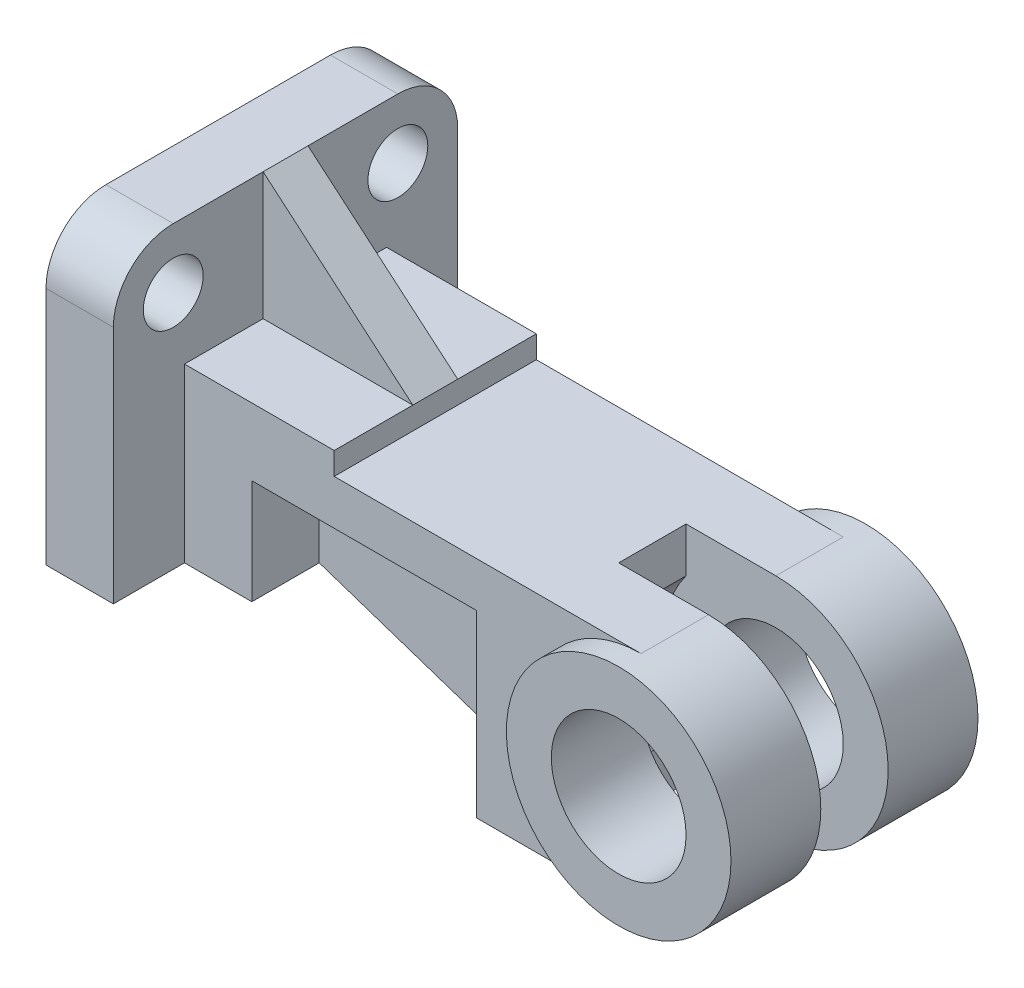
from build123d import *

# Parameters (mm, degrees)
BOSS_EXTRUDE1_DEPTH    = 46
BOSS_EXTRUDE2_DEPTH    = 27
BOSS_EXTRUDE3_START    = 33
SKETCH1_4_R            = 18
BOSS_EXTRUDE3_DEPTH    = 24
FILLET1_R              = 16
BOSS_EXTRUDE4_DEPTH    = 6
BOSS_EXTRUDE5_DEPTH    = 9
F_16_0MM_DOWEL_HOLE1_D = 16
SKETCH3_W              = 48
SKETCH3_H              = 18
CUT_EXTRUDE1_DEPTH     = 88


with BuildPart() as part:
    # Sketch1 → Boss-Extrude1 (new, symmetric)
    with BuildSketch(Plane.XY):
        Polygon((-122, 36), (-122, 70), (-140, 70), (-140, -10), (-122, -10), align=None)
    extrude(amount=BOSS_EXTRUDE1_DEPTH, both=True)

    # Sketch1<3> → Boss-Extrude2 (add, symmetric)
    with BuildSketch(Plane.XY):
        with BuildLine():
            ThreePointArc((0, -30), (-30, 0), (0, 30))
            Line((0, 30), (-82, 30))
            Line((-82, 30), (-82, 36))
            Line((-82, 36), (-122, 36))
            Line((-122, 36), (-122, -10))
            Line((-122, -10), (-104, -10))
            Line((-104, -10), (-104, 18))
            Line((-104, 18), (-44, 18))
            Line((-44, 18), (-44, -30))
            Line((-44, -30), (0, -30))
        make_face()
    extrude(amount=BOSS_EXTRUDE2_DEPTH, both=True)

    # Sketch1<4> → Boss-Extrude3 (add)
    with BuildSketch(Plane.XY.offset(BOSS_EXTRUDE3_START)):
        with BuildLine():
            ThreePointArc((30, 0), (21.213203436, 21.213203436), (0, 30))
            ThreePointArc((0, 30), (-30, 0), (0, -30))
            ThreePointArc((0, -30), (21.213203436, -21.213203436), (30, 0))
        make_face()
        Circle(SKETCH1_4_R, mode=Mode.SUBTRACT)
    boss_extrude3 = extrude(amount=-BOSS_EXTRUDE3_DEPTH)

    # Mirror1: Boss-Extrude3 across plane
    add(boss_extrude3.mirror(Plane.XY))

    # Fillet1
    fillet1_edges = [part.edges().sort_by_distance(p)[0] for p in [
        (-131, 70, -46),
        (-131, 70, 46),
    ]]
    fillet(fillet1_edges, radius=FILLET1_R)

    # Sketch1<7> → Boss-Extrude4 (add, symmetric)
    with BuildSketch(Plane.XY):
        Polygon((-122, 36), (-82, 36), (-122, 70), align=None)
    extrude(amount=BOSS_EXTRUDE4_DEPTH, both=True)

    # Sketch1<8> → Boss-Extrude5 (add, symmetric)
    with BuildSketch(Plane.XY):
        Polygon((-104, -10), (-44, -30), (-44, 18), (-104, 18), align=None)
    extrude(amount=BOSS_EXTRUDE5_DEPTH, both=True)

    # Ø16.0mm Dowel Hole1 (through all)
    with Locations(Plane(origin=(-122, 54, 30), x_dir=(0, 1, 0), z_dir=(1, 0, 0))):
        with Locations((0, 0), (0, -60)):
            Hole(F_16_0MM_DOWEL_HOLE1_D / 2)

    # Sketch3 → Cut-Extrude1 (cut)
    with BuildSketch(Plane(origin=(0, 30, 0), x_dir=(1, 0, 0), z_dir=(0, 1, 0))):
        Rectangle(SKETCH3_W, SKETCH3_H)
    extrude(amount=-CUT_EXTRUDE1_DEPTH, mode=Mode.SUBTRACT)


solid = part.part
